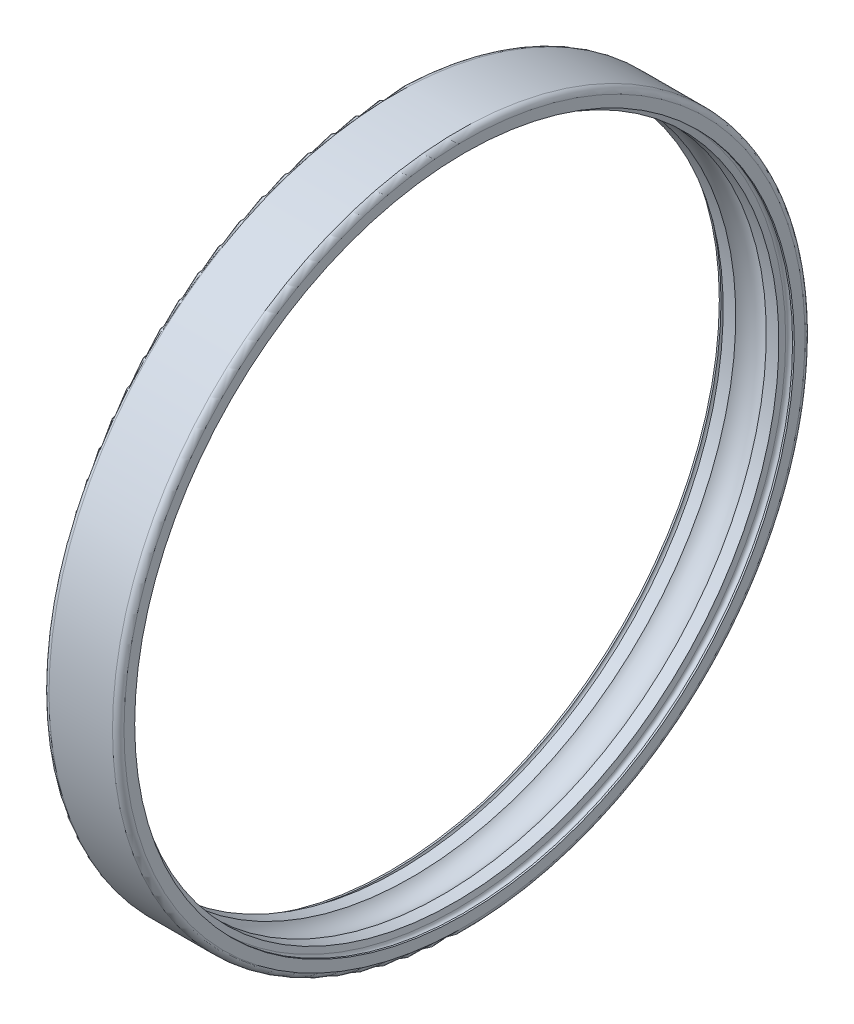
from build123d import *


with BuildPart() as part:
    # Schizzo1 → Rivoluzione1 (revolve)
    with BuildSketch(Plane.XY, mode=Mode.PRIVATE) as rivoluzione1_sk:
        with BuildLine():
            Line((0, 57.15), (0.3, 57.15))
            ThreePointArc((0.3, 57.15), (0.9, 57.75), (1.5, 57.15))
            Line((1.5, 57.15), (1.676326981, 56.15))
            Line((1.676326981, 56.15), (3.854402903, 56.15))
            ThreePointArc((3.854402903, 56.15), (6.5, 57.322), (9.145597097, 56.15))
            Line((9.145597097, 56.15), (11.323673019, 56.15))
            Line((11.323673019, 56.15), (11.5, 57.15))
            ThreePointArc((11.5, 57.15), (12.1, 57.75), (12.7, 57.15))
            Line((12.7, 57.15), (13, 57.15))
            Line((13, 57.15), (13, 59))
            ThreePointArc((13, 59), (12.707106781, 59.707106781), (12, 60))
            Line((12, 60), (1, 60))
            ThreePointArc((1, 60), (0.292893219, 59.707106781), (0, 59))
            Line((0, 59), (0, 57.15))
        make_face()
    revolve(rivoluzione1_sk.sketch.rotate(Axis((50, 0, 0), (-1, 0, 0)), 270), axis=Axis((50, 0, 0), (-1, 0, 0)))


solid = part.part
